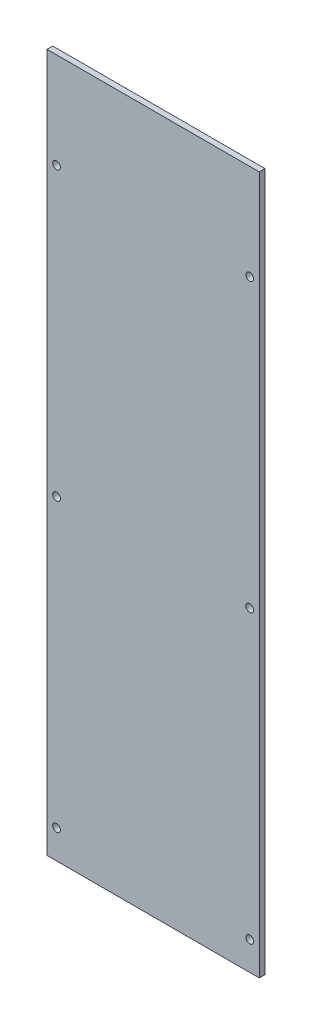
from build123d import *

# Parameters (mm, degrees)
SKETCH1_W           = 111
SKETCH1_H           = 365
SKETCH1_R           = 2
BOSS_EXTRUDE1_DEPTH = 3


with BuildPart() as part:
    # Sketch1 → Boss-Extrude1 (new body)
    with BuildSketch(Plane.XY):
        with Locations((0, 2.5)):
            Rectangle(SKETCH1_W, SKETCH1_H)
        with Locations((50.5, -15)):
            Circle(SKETCH1_R, mode=Mode.SUBTRACT)
        with Locations((-50.5, -15)):
            Circle(SKETCH1_R, mode=Mode.SUBTRACT)
        with Locations((-50.5, -165)):
            Circle(SKETCH1_R, mode=Mode.SUBTRACT)
        with Locations((50.5, -165)):
            Circle(SKETCH1_R, mode=Mode.SUBTRACT)
        with Locations((50.5, 135)):
            Circle(SKETCH1_R, mode=Mode.SUBTRACT)
        with Locations((-50.5, 135)):
            Circle(SKETCH1_R, mode=Mode.SUBTRACT)
    extrude(amount=BOSS_EXTRUDE1_DEPTH)


solid = part.part
